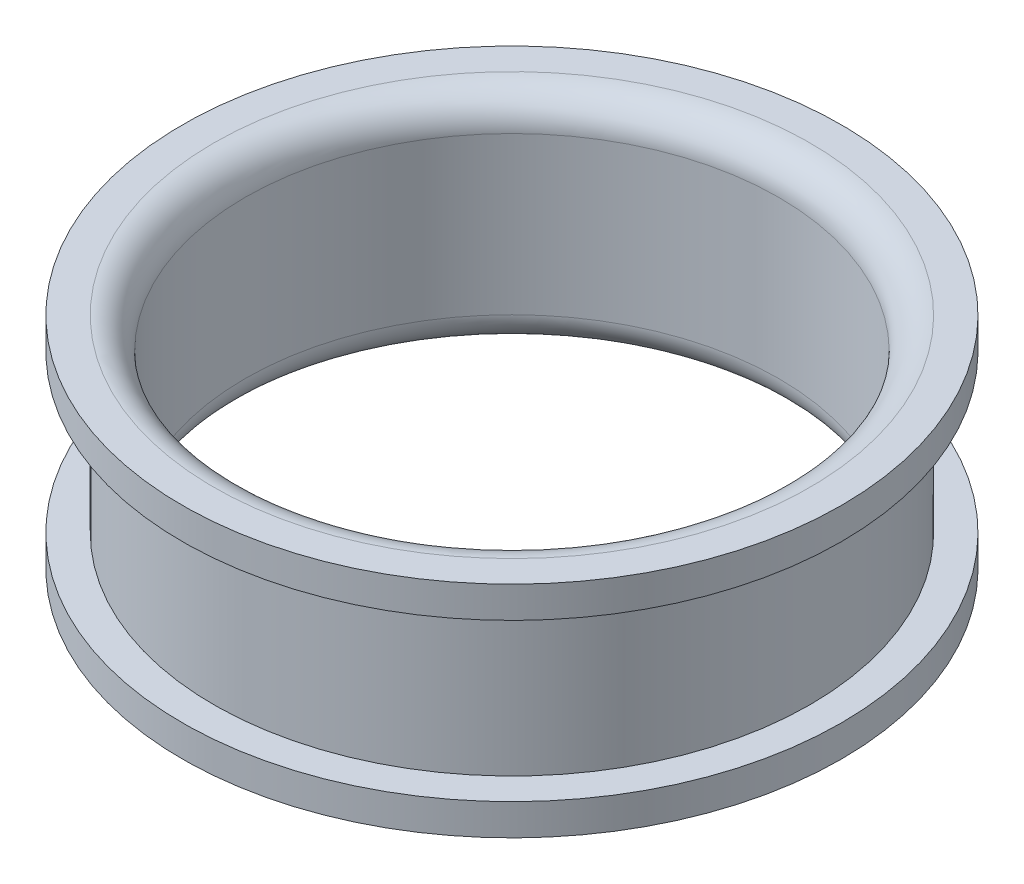
from build123d import *

# Parameters (mm, degrees)
FILLET1_R = 5


with BuildPart() as part:
    # Sketch1 → Revolve1 (revolve)
    with BuildSketch(Plane.XY):
        Polygon((52.5, 17.5), (42.5, 17.5), (42.5, -17.5), (52.5, -17.5), (52.5, -12.5), (47.5, -12.5), (47.5, 12.5), (52.5, 12.5), align=None)
    revolve(axis=Axis((0, -1019.449736873, 0), (0, 1, 0)))

    # Fillet1
    fillet1_edges = [part.edges().sort_by_distance(p)[0] for p in [
        (-42.5, -17.5, 0),
        (-42.5, 17.5, 0),
    ]]
    fillet(fillet1_edges, radius=FILLET1_R)


solid = part.part
